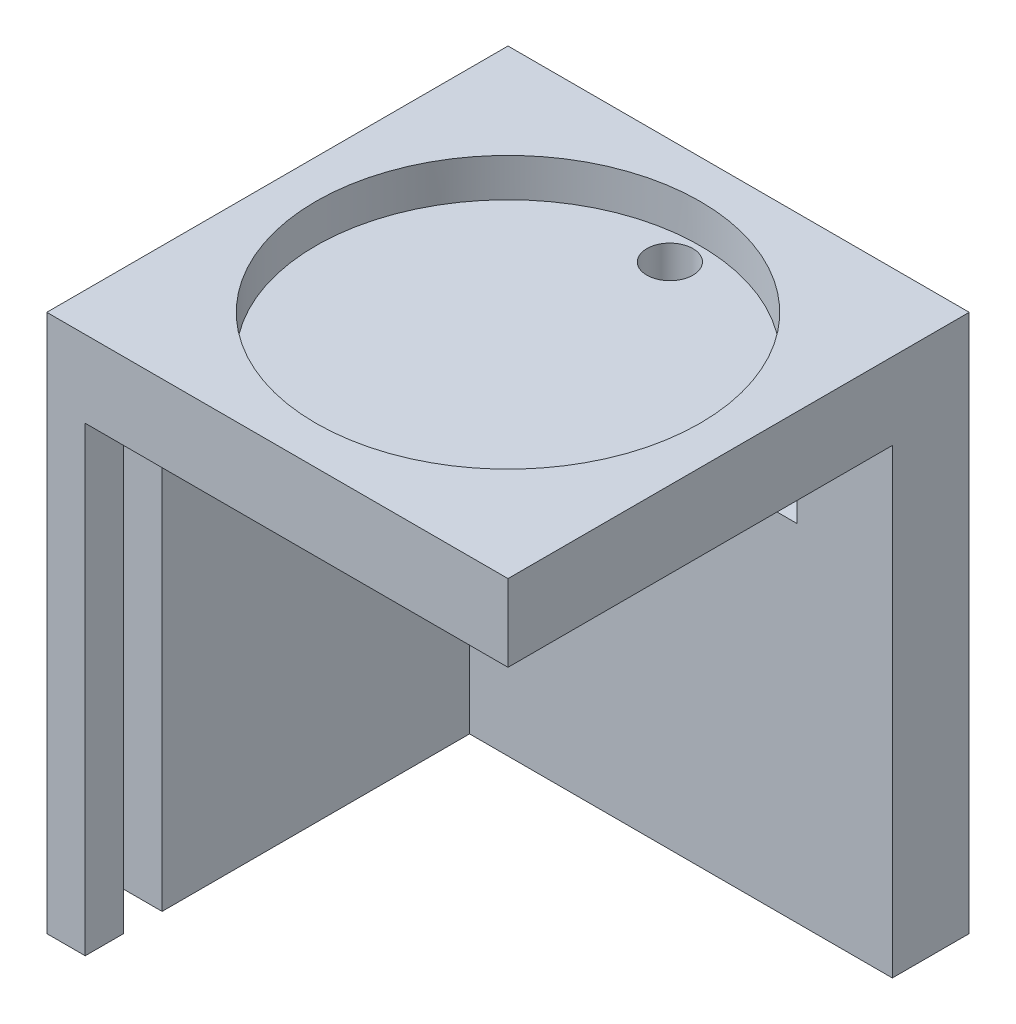
from build123d import *

# Parameters (mm, degrees)
SKETCH1_W                      = 670
SKETCH1_H                      = 120
BOSS_EXTRUDE1_DEPTH            = 530
SKETCH2_W                      = 100
SKETCH2_H                      = 200
SKETCH2_W_2                    = 650
SKETCH2_H_2                    = 250
CUT_EXTRUDE1_DEPTH             = 100
SKETCH3_R                      = 50
CUT_EXTRUDE2_DEPTH             = 260
F_12_0_12_DIAMETER_HOLE2_D     = 12
F_12_0_12_DIAMETER_HOLE2_DEPTH = 30
F_12_0_12_DIAMETER_HOLE2_TIP   = 3.605163714
SKETCH8_W                      = 650
SKETCH8_H                      = 50
BOSS_EXTRUDE2_DEPTH            = 5
SKETCH9_W                      = 10
SKETCH9_H                      = 250
CUT_EXTRUDE3_DEPTH             = 717
CUT_EXTRUDE4_DEPTH             = 5
SKETCH11_W                     = 10
SKETCH11_H                     = 100
BOSS_EXTRUDE3_DEPTH            = 78
BOSS_EXTRUDE3_2_DEPTH          = 78
BOSS_EXTRUDE3_3_DEPTH          = 78
SKETCH12_W                     = 20
SKETCH12_H                     = 30
CUT_EXTRUDE5_DEPTH             = 80
SKETCH15_W                     = 30
SKETCH15_H                     = 23.536156656
SKETCH15_H_2                   = 28.986603691
CUT_EXTRUDE7_DEPTH             = 35
SHELL1_T                       = -3
SKETCH16_W                     = 14
SKETCH16_H                     = 14
CUT_EXTRUDE8_DEPTH             = 35
SKETCH17_W                     = 5.729882812
SKETCH17_H                     = 17.428393554
SKETCH17_W_2                   = 13.369726562
SKETCH17_H_2                   = 3.342431641
BOSS_EXTRUDE4_DEPTH            = 5
CUT_EXTRUDE10_DEPTH            = 863.670273187
CUT_EXTRUDE10_DEPTH_BACK       = 863.670273187
SKETCH18_W                     = 670
SKETCH18_H                     = 250
CUT_EXTRUDE11_DEPTH            = 734.007503372
CUT_EXTRUDE11_DEPTH_BACK       = 734.007503372
SKETCH19_W                     = 550
SKETCH19_H                     = 280
CUT_EXTRUDE12_DEPTH            = 321.624390838
CUT_EXTRUDE12_DEPTH_BACK       = 321.624390838
SKETCH20_W                     = 120
SKETCH20_H                     = 140


with BuildPart() as part:
    # Sketch1 → Boss-Extrude1 (new body)
    with BuildSketch(Plane(origin=(0, 0, 0), x_dir=(1, 0, 0), z_dir=(0, 1, 0))):
        with Locations((335, 60)):
            Rectangle(SKETCH1_W, SKETCH1_H)
    extrude(amount=BOSS_EXTRUDE1_DEPTH)

    # Sketch2 → Cut-Extrude1 (cut)
    with BuildSketch(Plane.XY):
        with Locations((60, 380)):
            Rectangle(SKETCH2_W, SKETCH2_H)
        with Locations((170, 380)):
            Rectangle(SKETCH2_W, SKETCH2_H)
        with Locations((280, 380)):
            Rectangle(SKETCH2_W, SKETCH2_H)
        with Locations((390, 380)):
            Rectangle(SKETCH2_W, SKETCH2_H)
        with Locations((500, 380)):
            Rectangle(SKETCH2_W, SKETCH2_H)
        with Locations((610, 380)):
            Rectangle(SKETCH2_W, SKETCH2_H)
        with Locations((335, 135)):
            Rectangle(SKETCH2_W_2, SKETCH2_H_2)
    extrude(amount=-CUT_EXTRUDE1_DEPTH, mode=Mode.SUBTRACT)

    # Sketch3 → Cut-Extrude2 (cut)
    with BuildSketch(Plane(origin=(0, 530, 0), x_dir=(1, 0, 0), z_dir=(0, 1, 0))):
        with Locations(Location((60, 60, 0), (0, 0, 270))):
            Circle(SKETCH3_R)
        with Locations(Location((170, 60, 0), (0, 0, 270))):
            Circle(SKETCH3_R)
        with Locations(Location((280, 60, 0), (0, 0, 270))):
            Circle(SKETCH3_R)
        with Locations(Location((390, 60, 0), (0, 0, 270))):
            Circle(SKETCH3_R)
        with Locations(Location((500, 60, 0), (0, 0, 270))):
            Circle(SKETCH3_R)
        with Locations(Location((610, 60, 0), (0, 0, 270))):
            Circle(SKETCH3_R)
    extrude(amount=-CUT_EXTRUDE2_DEPTH, mode=Mode.SUBTRACT)

    # Ø12.0 (12) Diameter Hole2
    with Locations(Plane(origin=(59.704642413, 270, -102.411697903), x_dir=(0, 0, 1), z_dir=(0, 1, 0))):
        with Locations((0, 0), (-0.195888006, 111.8520513), (0.014838595, 221.167624818), (-0.341843303, 331.364008353), (0.657723149, 441.008646429), (1.288998006, 549.811854685)):
            Hole(F_12_0_12_DIAMETER_HOLE2_D / 2, depth=F_12_0_12_DIAMETER_HOLE2_DEPTH)
            with Locations((0, 0, -(F_12_0_12_DIAMETER_HOLE2_DEPTH + F_12_0_12_DIAMETER_HOLE2_TIP / 2))):  # 118° drill point
                Cone(0, F_12_0_12_DIAMETER_HOLE2_D / 2, F_12_0_12_DIAMETER_HOLE2_TIP, mode=Mode.SUBTRACT)

    # Sketch8 → Boss-Extrude2 (add)
    with BuildSketch(Plane.XY):
        with Locations((335, 305)):
            Rectangle(SKETCH8_W, SKETCH8_H)
    extrude(amount=-BOSS_EXTRUDE2_DEPTH)

    # Sketch9 → Cut-Extrude3 (cut)
    with BuildSketch(Plane(origin=(670, 0, 0), x_dir=(0, 0, -1), z_dir=(1, 0, 0))):
        with Locations((15, 135)):
            Rectangle(SKETCH9_W, SKETCH9_H)
    extrude(amount=-CUT_EXTRUDE3_DEPTH, mode=Mode.SUBTRACT)

    # Sketch10 → Cut-Extrude4 (cut)
    with BuildSketch(Plane(origin=(0, 10, 0), x_dir=(1, 0, 0), z_dir=(0, 1, 0))):
        Polygon((365, 61.943560596), (350, 87.924322709), (320, 87.924322709), (305, 61.943560596), (320, 35.962798482), (350, 35.962798482), align=None)
    extrude(amount=-CUT_EXTRUDE4_DEPTH, mode=Mode.SUBTRACT)

    # Sketch12 → Cut-Extrude5 (cut)
    with BuildSketch(Plane.XY.offset(-100)):
        with Locations((85.198613037, 245)):
            Rectangle(SKETCH12_W, SKETCH12_H)
        with Locations((195.198613037, 245)):
            Rectangle(SKETCH12_W, SKETCH12_H)
        with Locations((305.198613037, 245)):
            Rectangle(SKETCH12_W, SKETCH12_H)
        with Locations((415.198613037, 245)):
            Rectangle(SKETCH12_W, SKETCH12_H)
        with Locations((525.198613037, 245)):
            Rectangle(SKETCH12_W, SKETCH12_H)
        with Locations((635.198613037, 245)):
            Rectangle(SKETCH12_W, SKETCH12_H)
    extrude(amount=-CUT_EXTRUDE5_DEPTH, mode=Mode.SUBTRACT)

    # Sketch17 → Boss-Extrude4 (add)
    # profile 1 of 9: a face of its own
    with BuildSketch(Plane.XY):
        with BuildLine():
            Line((527.508830928, 289.835452458), (527.508830928, 307.263846012))
            Line((527.508830928, 307.263846012), (534.861434459, 307.263846012))
            add(Edge.make_bspline(
                [(534.861434459, 307.263846012), (535.181337774, 307.258256848), (535.803061116, 307.24739446), (536.703508491, 307.139069344), (537.544992916, 306.975202489), (538.325061607, 306.737496792), (539.040841948, 306.426020155), (539.698044515, 306.051894954), (540.290333057, 305.605079277), (540.822348212, 305.090232636), (541.284521701, 304.502523111), (541.692171296, 303.852565801), (542.030284458, 303.129762281), (542.309377095, 302.341316546), (542.5243908, 301.484161689), (542.679660381, 300.560045938), (542.773357357, 299.567500804), (542.783368073, 298.883107022), (542.788518428, 298.530997273)],
                knots=[0, 0, 0, 0, 1.135059408, 2.20595691, 3.214417064, 4.174978569, 5.094187092, 5.980001006, 6.853065862, 7.720814779, 8.600404634, 9.50058483, 10.438414914, 11.426825708, 12.465239141, 13.571113463, 14.750376389, 16, 16, 16, 16], degree=3))
            add(Edge.make_bspline(
                [(542.788518428, 298.530997273), (542.781740751, 298.180151665), (542.768592871, 297.499553336), (542.676885992, 296.511518461), (542.516733301, 295.591080531), (542.296748778, 294.736450427), (542.003051046, 293.953120444), (541.654236167, 293.233205539), (541.233025793, 292.585291498), (540.753136904, 292.000029304), (540.204772188, 291.484681411), (539.587651059, 291.044279297), (538.910779309, 290.668464036), (538.169670382, 290.361903209), (537.364073889, 290.124869172), (536.495133477, 289.954199984), (535.562644449, 289.853487388), (534.920131033, 289.841584621), (534.58911581, 289.835452458)],
                knots=[0, 0, 0, 0, 1.228418252, 2.382983832, 3.470276728, 4.496757894, 5.468023682, 6.394867725, 7.292157164, 8.167372942, 9.039072913, 9.918728341, 10.815246345, 11.744296628, 12.720973084, 13.750736166, 14.841206188, 16, 16, 16, 16], degree=3))
            Line((534.58911581, 289.835452458), (527.508830928, 289.835452458))
        make_face()
        with BuildLine():
            Line((533.238713741, 291.745413395), (534.048208904, 291.745413395))
            add(Edge.make_bspline(
                [(534.048208904, 291.745413395), (534.172894012, 291.749291978), (534.413033311, 291.756761998), (534.758676231, 291.825976613), (535.075745017, 291.938271137), (535.365749176, 292.094802589), (535.623404602, 292.300450923), (535.848862806, 292.551404902), (536.04776914, 292.844737637), (536.217685755, 293.190205032), (536.364284647, 293.596533622), (536.481764702, 294.076367921), (536.592118304, 294.630928744), (536.673672739, 295.265507643), (536.740044562, 295.978448886), (536.788346679, 296.768428292), (536.812018936, 297.636801208), (536.817188964, 298.241258393), (536.819890499, 298.55711002)],
                knots=[0, 0, 0, 0, 0.728710832, 1.403472396, 2.052289494, 2.690292559, 3.321919393, 3.970736491, 4.656696891, 5.388631723, 6.217040872, 7.17856157, 8.275589967, 9.523440737, 10.918935818, 12.463926104, 14.152268318, 16, 16, 16, 16], degree=3))
            add(Edge.make_bspline(
                [(536.819890499, 298.55711002), (536.8171426, 298.871715251), (536.811863063, 299.476166083), (536.7886758, 300.343334385), (536.739579947, 301.133216935), (536.674703848, 301.843934916), (536.589660404, 302.476324031), (536.488366458, 303.031681737), (536.362441588, 303.507627045), (536.222158727, 303.914921549), (536.050140993, 304.256514038), (535.858357073, 304.554097881), (535.62547107, 304.79746827), (535.36991257, 305.004888479), (535.079348843, 305.160875844), (534.761320266, 305.273944358), (534.414185903, 305.34216807), (534.172870641, 305.349893944), (534.048208904, 305.353885075)],
                knots=[0, 0, 0, 0, 1.842836665, 3.540640921, 5.080358154, 6.47765669, 7.719902824, 8.816971715, 9.781579111, 10.601733135, 11.334613876, 12.017393917, 12.666641099, 13.29908421, 13.937911793, 14.587567384, 15.270347425, 16, 16, 16, 16], degree=3))
            Line((534.048208904, 305.353885075), (533.238713741, 305.353885075))
            Line((533.238713741, 305.353885075), (533.238713741, 291.745413395))
        make_face(mode=Mode.SUBTRACT)
    # profile 2 of 9: a face of its own
    with BuildSketch(Plane.XY):
        with Locations((547.563420772, 298.549649235)):
            Rectangle(SKETCH17_W, SKETCH17_H)
    # profile 3 of 9: a face of its own
    with BuildSketch(Plane.XY):
        Polygon((564.514324092, 307.263846012), (564.514324092, 305.115139958), (558.545696163, 305.115139958), (558.545696163, 299.862747379), (563.559343624, 299.862747379), (563.559343624, 297.714041325), (558.545696163, 297.714041325), (558.545696163, 289.835452458), (552.81581335, 289.835452458), (552.81581335, 307.263846012), align=None)
    # profile 4 of 9: a face of its own
    with BuildSketch(Plane.XY):
        Polygon((577.645305538, 307.263846012), (577.645305538, 305.115139958), (571.676677608, 305.115139958), (571.676677608, 299.862747379), (576.690325069, 299.862747379), (576.690325069, 297.714041325), (571.676677608, 297.714041325), (571.676677608, 289.835452458), (565.946794795, 289.835452458), (565.946794795, 307.263846012), align=None)
    # profile 5 of 9: a face of its own
    with BuildSketch(Plane.XY):
        with Locations((584.330168819, 287.448001286)):
            Rectangle(SKETCH17_W_2, SKETCH17_H_2)
    # profile 6 of 9: a face of its own
    with BuildSketch(Plane.XY):
        with BuildLine():
            Line((605.578484249, 307.263846012), (605.578484249, 295.602639195))
            add(Edge.make_bspline(
                [(605.578484249, 295.602639195), (605.574209777, 295.35989389), (605.565919345, 294.889083964), (605.480877158, 294.20653885), (605.349958188, 293.569747554), (605.15926554, 292.978838165), (604.911867049, 292.436847071), (604.616163877, 291.936663973), (604.260702644, 291.487723021), (603.847299908, 291.08966617), (603.386881991, 290.731670113), (602.867295001, 290.425440037), (602.293741958, 290.168488385), (601.66690529, 289.960990771), (600.988052682, 289.797299786), (600.254912883, 289.679078851), (599.467035781, 289.60781007), (598.923618241, 289.60048219), (598.643684673, 289.59670734)],
                knots=[0, 0, 0, 0, 1.108173197, 2.149326602, 3.136215123, 4.073726706, 4.978516626, 5.852185058, 6.72141202, 7.584905625, 8.467554395, 9.379216169, 10.332422268, 11.332766067, 12.390653242, 13.518530507, 14.721707419, 16, 16, 16, 16], degree=3))
            add(Edge.make_bspline(
                [(598.643684673, 289.59670734), (598.373688491, 289.600411437), (597.851346557, 289.607577482), (597.093280473, 289.679448684), (596.387523889, 289.797736542), (595.733050135, 289.960122315), (595.130189942, 290.169220301), (594.579048171, 290.42623041), (594.078350789, 290.732835498), (593.633858028, 291.090104794), (593.234289459, 291.486851767), (592.899913678, 291.940746827), (592.609043638, 292.435866034), (592.375223767, 292.980322997), (592.191754821, 293.570441519), (592.063541006, 294.20666921), (591.983676196, 294.889343196), (591.974661767, 295.359932437), (591.970012569, 295.602639195)],
                knots=[0, 0, 0, 0, 1.258901956, 2.435505865, 3.547148904, 4.59359074, 5.576649289, 6.5183682, 7.424469602, 8.307507093, 9.172751023, 10.042627298, 10.928839176, 11.845659241, 12.799442865, 13.80597989, 14.868432463, 16, 16, 16, 16], degree=3))
            Line((591.970012569, 295.602639195), (591.970012569, 307.263846012))
            Line((591.970012569, 307.263846012), (597.699895381, 307.263846012))
            Line((597.699895381, 307.263846012), (597.699895381, 295.457153889))
            add(Edge.make_bspline(
                [(597.699895381, 295.457153889), (597.700816195, 295.287996189), (597.702584578, 294.963135903), (597.729908723, 294.499051493), (597.768241004, 294.079064133), (597.828226169, 293.705517832), (597.90066041, 293.377063412), (597.989882091, 293.09281535), (598.094998068, 292.852496478), (598.225239063, 292.654232043), (598.380826623, 292.495135011), (598.55368342, 292.353231761), (598.757556996, 292.238543846), (598.987648905, 292.146224908), (599.243380948, 292.070549638), (599.526120553, 292.020376099), (599.83553351, 291.990763905), (600.049971942, 291.986424568), (600.161954402, 291.984158512)],
                knots=[0, 0, 0, 0, 1.622370975, 3.115695595, 4.458049099, 5.666011203, 6.742434742, 7.681714947, 8.519814998, 9.250928664, 9.942747364, 10.646898194, 11.389596108, 12.175933929, 13.021386247, 13.943159715, 14.925891993, 16, 16, 16, 16], degree=3))
            add(Edge.make_bspline(
                [(600.161954402, 291.984158512), (600.283927219, 291.987190593), (600.521124756, 291.993087005), (600.86597014, 292.03390861), (601.187714881, 292.103380086), (601.484890424, 292.205377303), (601.758665297, 292.332852529), (602.012761516, 292.484567923), (602.236391413, 292.674631152), (602.439076761, 292.888441291), (602.620738276, 293.128529789), (602.771757722, 293.399928575), (602.905501548, 293.697121508), (603.005823683, 294.025060118), (603.089837826, 294.379999499), (603.146989706, 294.763086929), (603.186210275, 295.174074524), (603.189394751, 295.457053988), (603.191033077, 295.602639195)],
                knots=[0, 0, 0, 0, 1.083870311, 2.107775948, 3.08105344, 4.003637981, 4.893545291, 5.761570557, 6.624657808, 7.49233129, 8.376387281, 9.291996285, 10.246843261, 11.267344133, 12.334180325, 13.486053461, 14.706643157, 16, 16, 16, 16], degree=3))
            Line((603.191033077, 295.602639195), (603.191033077, 307.263846012))
            Line((603.191033077, 307.263846012), (605.578484249, 307.263846012))
        make_face()
    # profile 7 of 9: a face of its own
    with BuildSketch(Plane.XY):
        with BuildLine():
            Line((619.731593227, 302.015183827), (616.739818477, 301.526502415))
            add(Edge.make_bspline(
                [(616.739818477, 301.526502415), (616.748849224, 301.670726223), (616.765660669, 301.939210177), (616.78429066, 302.312269209), (616.796668381, 302.625642376), (616.798628236, 302.814722915), (616.799504756, 302.899286839)],
                knots=[0, 0, 0, 0, 1.261802504, 2.348944521, 3.261585937, 4, 4, 4, 4], degree=3))
            add(Edge.make_bspline(
                [(616.799504756, 302.899286839), (616.798306068, 303.007660677), (616.795968139, 303.219033721), (616.750451916, 303.523894877), (616.694806916, 303.811547356), (616.604352699, 304.076787391), (616.488181329, 304.320314265), (616.348943917, 304.543955606), (616.184187178, 304.745078709), (615.995833421, 304.928129987), (615.778009957, 305.083200131), (615.536269472, 305.218702836), (615.269765326, 305.333844758), (614.978065514, 305.431346685), (614.660683072, 305.504624438), (614.319025281, 305.556776695), (613.952471696, 305.585673441), (613.699597795, 305.590260771), (613.568984889, 305.592630192)],
                knots=[0, 0, 0, 0, 1.079280541, 2.105035848, 3.067950317, 3.99715044, 4.889989748, 5.753421302, 6.617030865, 7.476358039, 8.364190572, 9.274590025, 10.235106994, 11.254473582, 12.337095886, 13.478601727, 14.697662529, 16, 16, 16, 16], degree=3))
            add(Edge.make_bspline(
                [(613.568984889, 305.592630192), (613.391954632, 305.58912286), (613.059112606, 305.582528579), (612.595688488, 305.495339748), (612.198743126, 305.361419257), (611.87165349, 305.163811893), (611.613188167, 304.909795747), (611.433841092, 304.593316589), (611.323009072, 304.224665915), (611.313400221, 303.959558324), (611.308367061, 303.820693775)],
                knots=[0, 0, 0, 0, 1.294917039, 2.43462794, 3.440028966, 4.347597256, 5.210608309, 6.06356377, 6.985685997, 8, 8, 8, 8], degree=3))
            add(Edge.make_bspline(
                [(611.308367061, 303.820693775), (611.317562032, 303.705133219), (611.336106628, 303.472068433), (611.47315858, 303.132808312), (611.695999602, 302.811560885), (612.009295906, 302.510664216), (612.404107796, 302.221967273), (612.884407504, 301.948533431), (613.450813789, 301.688189695), (613.862519081, 301.536023727), (614.080048656, 301.455624958)],
                knots=[0, 0, 0, 0, 0.716839541, 1.445735977, 2.240793036, 3.131329288, 4.131129903, 5.273471266, 6.559404876, 8, 8, 8, 8], degree=3))
            add(Edge.make_bspline(
                [(614.080048656, 301.455624958), (614.335934702, 301.364918412), (614.834564244, 301.188164095), (615.547657928, 300.88707802), (616.213068388, 300.5749594), (616.829579094, 300.246613346), (617.397833174, 299.90520698), (617.914851624, 299.544556457), (618.386199073, 299.173962102), (618.807001026, 298.783874588), (619.177995113, 298.378100064), (619.4958685, 297.952745357), (619.771807525, 297.51723103), (619.991113975, 297.061458502), (620.169645242, 296.594624218), (620.292698657, 296.11024444), (620.364288243, 295.609761088), (620.37516617, 295.270864226), (620.380681514, 295.099036213)],
                knots=[0, 0, 0, 0, 1.359488612, 2.649152603, 3.874964776, 5.039588756, 6.146130126, 7.193090393, 8.194917302, 9.146793662, 10.063845301, 10.944476293, 11.803344532, 12.641736646, 13.473440096, 14.302714936, 15.139439897, 16, 16, 16, 16], degree=3))
            add(Edge.make_bspline(
                [(620.380681514, 295.099036213), (620.374476075, 294.902306495), (620.362285176, 294.515820995), (620.280160209, 293.948630617), (620.138011896, 293.409496554), (619.938489338, 292.895972278), (619.681049879, 292.411946655), (619.366518754, 291.954381076), (618.996510229, 291.525099427), (618.5710008, 291.128381035), (618.102222518, 290.765302239), (617.587803957, 290.450854345), (617.034458515, 290.187092261), (616.444107988, 289.968993032), (615.81453624, 289.801373099), (615.145337453, 289.685291013), (614.438790193, 289.606619894), (613.954683001, 289.600062276), (613.70700941, 289.59670734)],
                knots=[0, 0, 0, 0, 0.972121714, 1.909782367, 2.824924061, 3.721832975, 4.62620438, 5.527836938, 6.46026819, 7.421000932, 8.398101015, 9.385579713, 10.394244048, 11.422703992, 12.491421888, 13.608778581, 14.776629625, 16, 16, 16, 16], degree=3))
            add(Edge.make_bspline(
                [(613.70700941, 289.59670734), (613.445745367, 289.599650312), (612.939893069, 289.605348413), (612.207608113, 289.66709241), (611.525297432, 289.760984454), (610.893395078, 289.899706116), (610.309273131, 290.072394336), (609.776099392, 290.288320955), (609.295310255, 290.547303481), (608.863217672, 290.843007892), (608.478306623, 291.175775461), (608.148120946, 291.551766865), (607.86942369, 291.967163224), (607.639947144, 292.421521488), (607.466477665, 292.917583541), (607.339164663, 293.449829748), (607.264537999, 294.021332449), (607.254747521, 294.414908557), (607.249700069, 294.617815586)],
                knots=[0, 0, 0, 0, 1.342201143, 2.598733168, 3.773451092, 4.878874364, 5.91991243, 6.900006476, 7.829142054, 8.72062616, 9.585588575, 10.436728592, 11.283829734, 12.149664931, 13.044964919, 13.977937424, 14.957531465, 16, 16, 16, 16], degree=3))
            add(Edge.make_bspline(
                [(607.249700069, 294.617815586), (607.250803815, 294.692425759), (607.253213998, 294.855347393), (607.260452266, 295.122772538), (607.275636683, 295.433682216), (607.29037174, 295.656130545), (607.298195171, 295.774237248)],
                knots=[0, 0, 0, 0, 0.773500207, 1.689044709, 2.77302154, 4, 4, 4, 4], degree=3))
            Line((607.298195171, 295.774237248), (610.36457777, 296.337526509))
            add(Edge.make_bspline(
                [(610.36457777, 296.337526509), (610.326952988, 296.136337493), (610.255606535, 295.754830366), (610.178678473, 295.21219969), (610.124206629, 294.733311493), (610.11767002, 294.435147371), (610.114641475, 294.297001835)],
                knots=[0, 0, 0, 0, 1.192988372, 2.262218769, 3.194850416, 4, 4, 4, 4], degree=3))
            add(Edge.make_bspline(
                [(610.114641475, 294.297001835), (610.116191817, 294.183708768), (610.119182568, 293.965156219), (610.159053378, 293.648552813), (610.215988606, 293.352999663), (610.302906772, 293.079707227), (610.411206928, 292.826307836), (610.544682453, 292.59538211), (610.704385489, 292.386485019), (610.887496571, 292.200099922), (611.094689168, 292.033628705), (611.327456494, 291.892756696), (611.58347653, 291.771733922), (611.864681562, 291.677479524), (612.167961721, 291.596080628), (612.497219749, 291.548235723), (612.849461228, 291.512043782), (613.092629543, 291.508500084), (613.218327999, 291.506668278)],
                knots=[0, 0, 0, 0, 1.135776692, 2.191015738, 3.19649269, 4.151244236, 5.061952528, 5.956281389, 6.819534407, 7.692823504, 8.571441916, 9.478554956, 10.416037156, 11.406231466, 12.450054172, 13.561596327, 14.739541482, 16, 16, 16, 16], degree=3))
            add(Edge.make_bspline(
                [(613.218327999, 291.506668278), (613.423996012, 291.510791273), (613.810619321, 291.518541853), (614.349272542, 291.616708407), (614.810575885, 291.768742445), (615.189785268, 291.991387532), (615.490778961, 292.278756613), (615.698005174, 292.637320004), (615.824813318, 293.05638326), (615.837728413, 293.355975238), (615.844524288, 293.513619419)],
                knots=[0, 0, 0, 0, 1.308765556, 2.460272085, 3.475015317, 4.388076298, 5.239673503, 6.095681635, 6.997954785, 8, 8, 8, 8], degree=3))
            add(Edge.make_bspline(
                [(615.844524288, 293.513619419), (615.833808824, 293.638242951), (615.811807312, 293.894126055), (615.644884004, 294.264515838), (615.382382362, 294.620631473), (615.016807277, 294.962984909), (614.551376589, 295.293471235), (613.986957743, 295.616730224), (613.322148235, 295.933112033), (612.83677959, 296.119639164), (612.580430889, 296.21815395)],
                knots=[0, 0, 0, 0, 0.667930748, 1.371427933, 2.146459016, 3.034714139, 4.04893387, 5.207327294, 6.525042705, 8, 8, 8, 8], degree=3))
            add(Edge.make_bspline(
                [(612.580430889, 296.21815395), (612.374354345, 296.29679374), (611.970646869, 296.450850434), (611.394079385, 296.713586304), (610.853066711, 296.987016804), (610.357486361, 297.288235735), (609.896382561, 297.599610528), (609.477036946, 297.932256792), (609.09841673, 298.284556341), (608.758710772, 298.653375077), (608.457302107, 299.038989264), (608.199448649, 299.444659231), (607.977533299, 299.866789834), (607.798609588, 300.308107488), (607.65975715, 300.767821241), (607.559616231, 301.244439392), (607.497905054, 301.739995674), (607.491630423, 302.075933546), (607.488445186, 302.246468159)],
                knots=[0, 0, 0, 0, 1.249558333, 2.447906163, 3.58867143, 4.682264114, 5.731748367, 6.739728761, 7.711906036, 8.659384707, 9.578321416, 10.481344598, 11.379544271, 12.277135726, 13.175418307, 14.097160112, 15.034047388, 16, 16, 16, 16], degree=3))
            add(Edge.make_bspline(
                [(607.488445186, 302.246468159), (607.49282555, 302.439538736), (607.501402184, 302.817565692), (607.587451154, 303.36980586), (607.719291893, 303.894921371), (607.910558542, 304.389343064), (608.156192894, 304.852853762), (608.453187669, 305.288766511), (608.804241719, 305.697593471), (609.213503754, 306.066686531), (609.657214714, 306.407618241), (610.14376173, 306.697651931), (610.658716537, 306.950861947), (611.210636666, 307.148827868), (611.791820619, 307.313252612), (612.408080529, 307.421140415), (613.056315391, 307.490701612), (613.499160755, 307.498567824), (613.725661373, 307.502591129)],
                knots=[0, 0, 0, 0, 1.01033566, 1.978209831, 2.919499157, 3.840961976, 4.746855014, 5.660740114, 6.597989116, 7.56120833, 8.541877795, 9.523498025, 10.522416858, 11.542172371, 12.589598349, 13.681636521, 14.814234488, 16, 16, 16, 16], degree=3))
            add(Edge.make_bspline(
                [(613.725661373, 307.502591129), (613.968269855, 307.498219033), (614.438190994, 307.489750488), (615.120391152, 307.426787419), (615.755073228, 307.319142339), (616.345153155, 307.171557286), (616.887304575, 306.977590666), (617.384933999, 306.742393454), (617.834452216, 306.46201507), (618.236961315, 306.139451502), (618.593086714, 305.773322851), (618.897467704, 305.361641069), (619.158701245, 304.909408454), (619.366684143, 304.412232174), (619.529870326, 303.873247147), (619.649133834, 303.29158184), (619.720420497, 302.667301443), (619.72779778, 302.236712324), (619.731593227, 302.015183827)],
                knots=[0, 0, 0, 0, 1.248314423, 2.417925914, 3.521398822, 4.558068205, 5.543720209, 6.479599284, 7.385061127, 8.263440163, 9.127722873, 10.00561236, 10.891325273, 11.808802823, 12.772251995, 13.784947978, 14.860405143, 16, 16, 16, 16], degree=3))
        make_face()
    # profile 8 of 9: a face of its own
    with BuildSketch(Plane.XY):
        Polygon((633.989153194, 307.263846012), (633.989153194, 305.115139958), (628.020525264, 305.115139958), (628.020525264, 300.340237614), (633.034172725, 300.340237614), (633.034172725, 298.191531559), (628.020525264, 298.191531559), (628.020525264, 291.984158512), (634.944133663, 291.984158512), (634.944133663, 289.835452458), (622.290642452, 289.835452458), (622.290642452, 307.263846012), align=None)
    # profile 9 of 9: a face of its own
    with BuildSketch(Plane.XY):
        with BuildLine():
            Line((636.376604366, 289.835452458), (636.376604366, 307.263846012))
            Line((636.376604366, 307.263846012), (643.990335369, 307.263846012))
            add(Edge.make_bspline(
                [(643.990335369, 307.263846012), (644.237946498, 307.261150834), (644.721600887, 307.25588639), (645.426490561, 307.189203683), (646.094808274, 307.090496236), (646.724915796, 306.949857504), (647.317873659, 306.767252686), (647.871119087, 306.542146), (648.390701058, 306.282329135), (648.864494846, 305.976472528), (649.295093616, 305.642889252), (649.669668547, 305.279483604), (649.990389523, 304.894749072), (650.250664962, 304.483256345), (650.454275633, 304.048690948), (650.59581384, 303.587791605), (650.684089268, 303.104102537), (650.695510601, 302.772834174), (650.701311397, 302.604585835)],
                knots=[0, 0, 0, 0, 1.303269877, 2.545653735, 3.724355284, 4.8584284, 5.941462088, 6.987020715, 8.000098032, 8.995332524, 9.951400474, 10.863507538, 11.737823931, 12.582415999, 13.420128714, 14.25671499, 15.114600608, 16, 16, 16, 16], degree=3))
            add(Edge.make_bspline(
                [(650.701311397, 302.604585835), (650.698282873, 302.472674957), (650.692382063, 302.215658276), (650.651041486, 301.838684287), (650.580643818, 301.480313933), (650.481036683, 301.139915259), (650.347814833, 300.820175594), (650.191279492, 300.517863507), (650.009772227, 300.230553342), (649.788675198, 299.970497982), (649.548268341, 299.722842359), (649.274558803, 299.497116911), (648.974487035, 299.288655528), (648.642526299, 299.104010513), (648.287619671, 298.928055749), (647.899038177, 298.784921972), (647.486819978, 298.644749395), (647.19793098, 298.577036306), (647.049257183, 298.54218845)],
                knots=[0, 0, 0, 0, 1.057156483, 2.059775939, 3.035078039, 3.981068617, 4.897189472, 5.80650904, 6.70770952, 7.613691521, 8.536886357, 9.470937334, 10.45233069, 11.461024139, 12.51295332, 13.623444893, 14.776929983, 16, 16, 16, 16], degree=3))
            add(Edge.make_bspline(
                [(647.049257183, 298.54218845), (647.19164695, 298.499279419), (647.467865022, 298.416041346), (647.856360945, 298.265600017), (648.211652989, 298.111536308), (648.524185739, 297.936781388), (648.807636894, 297.762122504), (649.047122259, 297.564301324), (649.255235567, 297.361673563), (649.425188343, 297.135464734), (649.570253643, 296.882344437), (649.694827156, 296.586596707), (649.815179167, 296.247423665), (649.917667348, 295.859098311), (650.004750555, 295.423699276), (650.088222437, 294.944027189), (650.153853601, 294.416024546), (650.187587341, 294.048412906), (650.2051692, 293.856815525)],
                knots=[0, 0, 0, 0, 1.149282524, 2.229462177, 3.219229774, 4.139917433, 4.995948464, 5.788695735, 6.536448429, 7.236319808, 7.968460079, 8.78645307, 9.713791991, 10.749194692, 11.887975363, 13.146018663, 14.512518948, 16, 16, 16, 16], degree=3))
            add(Edge.make_bspline(
                [(650.2051692, 293.856815525), (650.225980287, 293.627849833), (650.265975604, 293.187817268), (650.348933081, 292.554613589), (650.44386163, 291.974357025), (650.555874504, 291.44528724), (650.681301216, 290.967898855), (650.821280597, 290.540469593), (650.979920039, 290.165788217), (651.10484481, 289.941461656), (651.163880062, 289.835452458)],
                knots=[0, 0, 0, 0, 1.324580516, 2.545615266, 3.678710841, 4.711533017, 5.660403917, 6.521349952, 7.301239649, 8, 8, 8, 8], degree=3))
            Line((651.163880062, 289.835452458), (645.213904094, 289.835452458))
            add(Edge.make_bspline(
                [(645.213904094, 289.835452458), (645.12229736, 290.069847279), (644.935171241, 290.548648246), (644.7595281, 291.319414791), (644.64846922, 292.142514735), (644.635117598, 292.70994511), (644.628232479, 293.002555653)],
                knots=[0, 0, 0, 0, 0.930410518, 1.900560147, 2.917368081, 4, 4, 4, 4], degree=3))
            Line((644.628232479, 293.002555653), (644.605850124, 294.002300831))
            Line((644.605850124, 294.002300831), (644.579737377, 295.266903874))
            add(Edge.make_bspline(
                [(644.579737377, 295.266903874), (644.573694669, 295.477395004), (644.562357007, 295.872330118), (644.469348432, 296.426164013), (644.30178735, 296.894645884), (644.073222546, 297.287223005), (643.766741442, 297.590613479), (643.39104803, 297.804152917), (642.950456912, 297.93396284), (642.634664848, 297.946292392), (642.468335247, 297.952786442)],
                knots=[0, 0, 0, 0, 1.295300309, 2.430314163, 3.439929415, 4.342995669, 5.203512789, 6.060756153, 6.978588463, 8, 8, 8, 8], degree=3))
            Line((642.468335247, 297.952786442), (642.106487178, 297.952786442))
            Line((642.106487178, 297.952786442), (642.106487178, 289.835452458))
            Line((642.106487178, 289.835452458), (636.376604366, 289.835452458))
        make_face()
        with BuildLine():
            Line((642.106487178, 299.862747379), (642.617550945, 299.862747379))
            add(Edge.make_bspline(
                [(642.617550945, 299.862747379), (642.722054451, 299.865172716), (642.925280724, 299.869889229), (643.220054897, 299.898289891), (643.494111408, 299.951809873), (643.749840966, 300.021017819), (643.984372137, 300.114851792), (644.200147241, 300.225818296), (644.391160406, 300.362685327), (644.565327067, 300.516342321), (644.718148635, 300.691986294), (644.850351299, 300.889034217), (644.961199162, 301.106225057), (645.056078491, 301.342818683), (645.125883912, 301.600830857), (645.173262731, 301.879472914), (645.203404658, 302.177423605), (645.207875435, 302.383174491), (645.210173702, 302.488943669)],
                knots=[0, 0, 0, 0, 1.184986479, 2.304423995, 3.352332712, 4.347714965, 5.303263624, 6.211353909, 7.091434645, 7.960150225, 8.839440182, 9.723126897, 10.64371617, 11.599264829, 12.608232147, 13.667459739, 14.800924404, 16, 16, 16, 16], degree=3))
            add(Edge.make_bspline(
                [(645.210173702, 302.488943669), (645.207875435, 302.594712847), (645.203404658, 302.800463732), (645.173262731, 303.098414423), (645.125883912, 303.37705648), (645.056078491, 303.635068654), (644.961199162, 303.87166228), (644.850351299, 304.08885312), (644.718148635, 304.285901043), (644.565327067, 304.461545017), (644.391160406, 304.61520201), (644.200147241, 304.752069041), (643.984372137, 304.863035546), (643.749840966, 304.956869518), (643.494111408, 305.026077464), (643.220054897, 305.079597446), (642.925280724, 305.107998108), (642.722054451, 305.112714621), (642.617550945, 305.115139958)],
                knots=[0, 0, 0, 0, 1.199075596, 2.332540261, 3.391767853, 4.400735171, 5.35628383, 6.276873103, 7.160559818, 8.039849775, 8.908565355, 9.788646091, 10.696736376, 11.652285035, 12.647667288, 13.695576005, 14.815013521, 16, 16, 16, 16], degree=3))
            Line((642.617550945, 305.115139958), (642.106487178, 305.115139958))
            Line((642.106487178, 305.115139958), (642.106487178, 299.862747379))
        make_face(mode=Mode.SUBTRACT)
    extrude(amount=BOSS_EXTRUDE4_DEPTH)

    # Sketch18 → Cut-Extrude10 (cut, two sides: drawn at the far end of the back side and taken through both)
    with BuildSketch(Plane.XY.offset(-CUT_EXTRUDE10_DEPTH_BACK)):
        with Locations((335, 405)):
            Rectangle(SKETCH18_W, SKETCH18_H)
    extrude(amount=CUT_EXTRUDE10_DEPTH + CUT_EXTRUDE10_DEPTH_BACK, mode=Mode.SUBTRACT)

    # Sketch19 → Cut-Extrude11 (cut, two sides: drawn at the far end of the back side and taken through both)
    with BuildSketch(Plane.XY.offset(-100).offset(-CUT_EXTRUDE11_DEPTH_BACK)):
        with Locations((395, 140)):
            Rectangle(SKETCH19_W, SKETCH19_H)
    extrude(amount=CUT_EXTRUDE11_DEPTH + CUT_EXTRUDE11_DEPTH_BACK, mode=Mode.SUBTRACT)

    # Sketch20 → Cut-Extrude12 (cut, two sides: drawn at the far end of the back side and taken through both)
    with BuildSketch(Plane.XY.offset(-100).offset(-CUT_EXTRUDE12_DEPTH_BACK)):
        with Locations((60, 70)):
            Rectangle(SKETCH20_W, SKETCH20_H)
    extrude(amount=CUT_EXTRUDE12_DEPTH + CUT_EXTRUDE12_DEPTH_BACK, mode=Mode.SUBTRACT)


with BuildPart() as body_2:
    # Sketch11 → Boss-Extrude3 (new body)
    with BuildSketch(Plane.XY.offset(-100)):
        with Locations((255, 60)):
            Rectangle(SKETCH11_W, SKETCH11_H)
    extrude(amount=BOSS_EXTRUDE3_DEPTH)


with BuildPart() as body_3:
    # Sketch11 → Boss-Extrude3 2 (new body)
    with BuildSketch(Plane.XY.offset(-100)):
        with Locations((415, 60)):
            Rectangle(SKETCH11_W, SKETCH11_H)
    extrude(amount=BOSS_EXTRUDE3_2_DEPTH)


with BuildPart() as body_4:
    # Sketch11 → Boss-Extrude3 3 (new body)
    with BuildSketch(Plane.XY.offset(-100)):
        Polygon((25, 198.45686471), (325, 145.558770497), (325, 122.01775856), (345, 122.01775856), (345, 145.558770497), (645, 198.45686471), align=None)
    extrude(amount=BOSS_EXTRUDE3_3_DEPTH)

    # Sketch15 → Cut-Extrude7 (cut)
    with BuildSketch(Plane(origin=(345, 0, 0), x_dir=(0, 0, -1), z_dir=(1, 0, 0))):
        with Locations((35, 133.231921672)):
            Rectangle(SKETCH15_W, SKETCH15_H)
        with Locations((85, 130.506698154)):
            Rectangle(SKETCH15_W, SKETCH15_H_2)
    extrude(amount=-CUT_EXTRUDE7_DEPTH, mode=Mode.SUBTRACT)

    # Shell1
    shell1_openings = [body_4.faces().sort_by_distance(p)[0] for p in [
        (335, 198.45686471, -61),
    ]]
    offset(amount=SHELL1_T, openings=shell1_openings, kind=Kind.INTERSECTION)

    # Sketch16 → Cut-Extrude8 (cut)
    with BuildSketch(Plane.XZ.offset(-122.01775856)):
        with Locations((335, -60)):
            Rectangle(SKETCH16_W, SKETCH16_H)
    extrude(amount=-CUT_EXTRUDE8_DEPTH, mode=Mode.SUBTRACT)


solid = part.part
